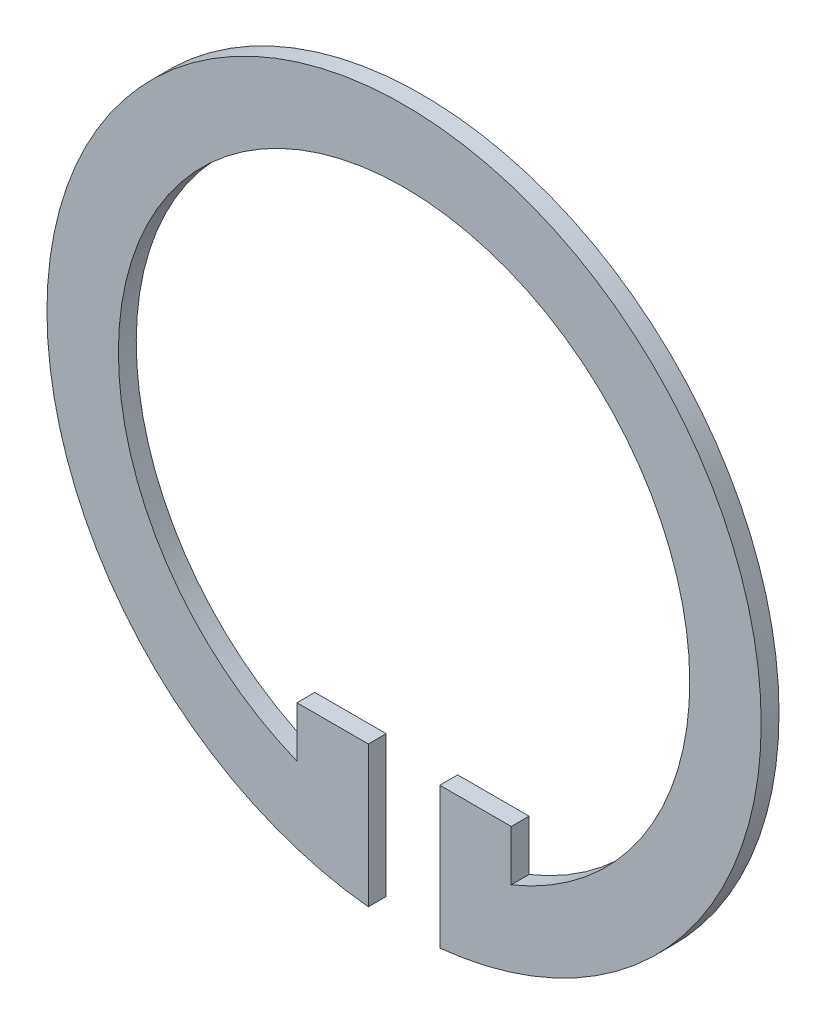
from build123d import *

# Parameters (mm, degrees)
EXTRUDE_1_DEPTH = 0.5


with BuildPart() as part:
    # 草图1 → 拉伸1 (new body)
    with BuildSketch(Plane.XY):
        with BuildLine():
            Line((-1, -6), (-1, -9.949874371))
            ThreePointArc((-1, -9.949874371), (0, 10), (1, -9.949874371))
            Line((1, -9.949874371), (1, -6))
            Line((1, -6), (3, -6))
            Line((3, -6), (3, -7.416198487))
            ThreePointArc((3, -7.416198487), (0, 8), (-3, -7.416198487))
            Line((-3, -7.416198487), (-3, -6))
            Line((-3, -6), (-1, -6))
        make_face()
    extrude(amount=EXTRUDE_1_DEPTH)


solid = part.part
